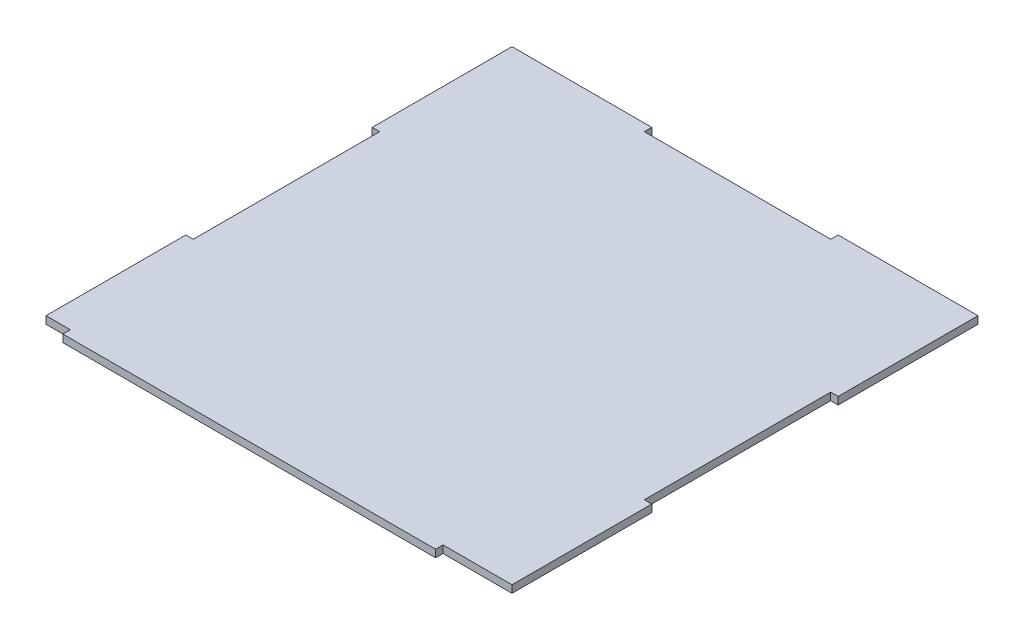
from build123d import *

# Parameters (mm, degrees)
BOSS_EXTRUDE3_DEPTH = 4


with BuildPart() as part:
    # Sketch1 → Boss-Extrude3 (new body)
    with BuildSketch(Plane(origin=(0, 0, 0), x_dir=(1, 0, 0), z_dir=(0, 1, 0))):
        Polygon((-125, 2.352363688), (-112, 2.352363688), (-112, -1.647636312), (88, -1.647636312), (88, 2.352363688), (125, 2.352363688), (125, 77.352363688), (121, 77.352363688), (121, 177.352363688), (125, 177.352363688), (125, 252.352363688), (50, 252.352363688), (50, 248.352363688), (-50, 248.352363688), (-50, 252.352363688), (-125, 252.352363688), (-125, 177.352363688), (-121, 177.352363688), (-121, 77.352363688), (-125, 77.352363688), align=None)
    extrude(amount=BOSS_EXTRUDE3_DEPTH)


solid = part.part
